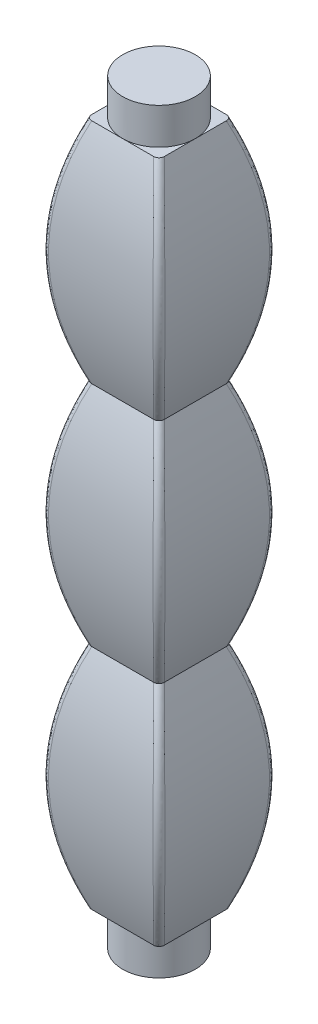
from build123d import *

# Parameters (mm, degrees)
LPATTERN1_COUNT = 3
LPATTERN1_PITCH = 15.666
FILLET5_R       = 0.4


with BuildPart() as part:
    # Sketch1 → Revolve1 (revolve)
    with BuildSketch(Plane.XY):
        Polygon((0, 3.266477511), (2.5, 3.266477511), (2.5, 5.766477511), (0.857476688, 5.766477511), (0.857476688, 52.766477511), (2.5, 52.766477511), (2.5, 55.266477511), (0, 55.266477511), (0, 29.266477511), align=None)
    revolve(axis=Axis((0, 3.266477511, 0), (0, 1, 0)))

    # Sketch2 → Loft1 section 0
    with BuildSketch(Plane(origin=(0, 52.766477511, 0), x_dir=(-1, 0, 0), z_dir=(0, -1, 0))):
        with BuildLine():
            Line((-2.5, -2.5), (2.5, -2.5))
            Line((2.5, -2.5), (2.5, 2.5))
            Line((2.5, 2.5), (-2.5, 2.5))
            Line((-2.5, 2.5), (-2.5, -2.5))
        make_face()
    # Sketch6 → Loft1 section 1
    with BuildSketch(Plane(origin=(0, 44.933144511, 0), x_dir=(-1, 0, 0), z_dir=(0, -1, 0))):
        with BuildLine():
            Line((-4, -4), (4, -4))
            Line((4, -4), (4, 4))
            Line((4, 4), (-4, 4))
            Line((-4, 4), (-4, -4))
        make_face()
    # Sketch5 → Loft1 section 2
    with BuildSketch(Plane(origin=(0, 37.099811511, 0), x_dir=(-1, 0, 0), z_dir=(0, -1, 0))):
        with BuildLine():
            Line((-2.5, -2.5), (2.5, -2.5))
            Line((2.5, -2.5), (2.5, 2.5))
            Line((2.5, 2.5), (-2.5, 2.5))
            Line((-2.5, 2.5), (-2.5, -2.5))
        make_face()
    loft1 = loft()

    # LPattern1: Loft1 ×3
    with Locations(*[(0, -i * LPATTERN1_PITCH, 0) for i in range(1, LPATTERN1_COUNT)]):
        add(loft1)

    # Fillet5
    fillet5_edges = [part.edges().sort_by_distance(p)[0] for p in [
        (-3.999999999, 44.933334257, 3.999999999),
        (-4, 29.267144905, 4),
        (-3.999999999, 13.600955553, 3.999999999),
        (-3.999999999, 44.933334257, -3.999999999),
        (-4, 29.267144905, -4),
        (-3.999999999, 13.600955553, -3.999999999),
        (3.999999999, 13.600955553, 3.999999999),
        (4, 29.267144905, 4),
        (3.999999999, 44.933334257, 3.999999999),
        (3.999999999, 13.600955553, -3.999999999),
        (4, 29.267144905, -4),
        (3.999999999, 44.933334257, -3.999999999),
    ]]
    fillet(fillet5_edges, radius=FILLET5_R)


solid = part.part
